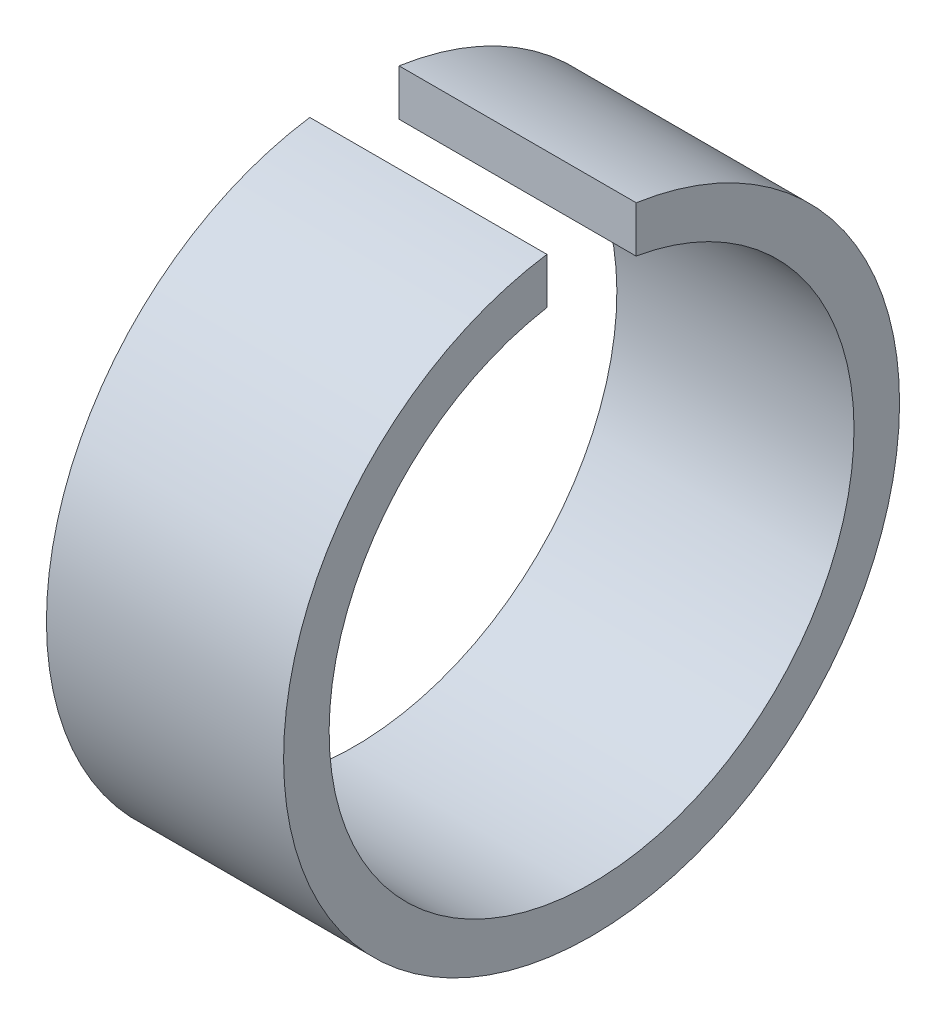
from build123d import *

# Parameters (mm, degrees)
BOSS_EXTRUDE1_DEPTH = 19.05


with BuildPart() as part:
    # Sketch1 → Boss-Extrude1 (new body)
    with BuildSketch(Plane(origin=(0, 0, 0), x_dir=(0, 0, -1), z_dir=(1, 0, 0))):
        with BuildLine():
            Line((3.571133178, 20.777336976), (3.587242, 24.478143373))
            ThreePointArc((3.587242, 24.478143373), (0, -24.7396), (-3.587242, 24.478143373))
            Line((-3.587242, 24.478143373), (-3.571133178, 20.777336976))
            ThreePointArc((-3.571133178, 20.777336976), (0, -21.082), (3.571133178, 20.777336976))
        make_face()
    extrude(amount=BOSS_EXTRUDE1_DEPTH)


solid = part.part
